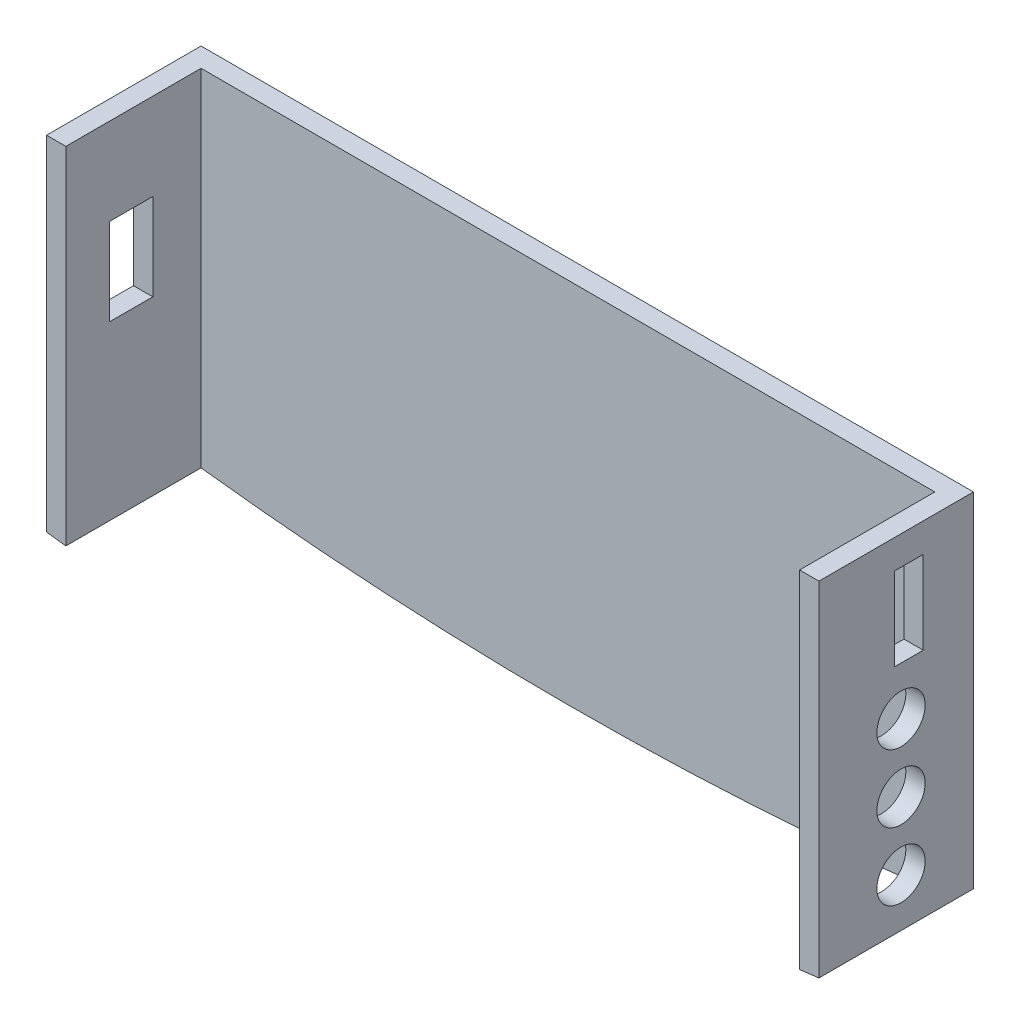
from build123d import *

# Parameters (mm, degrees)
SKETCH_1_W          = 80
SKETCH_1_H          = 35.6
EXTRUDE_1_DEPTH     = 16
SHELL_1_T           = -2
CUT_EXTRUDE_3_REACH = 89.549
SKETCH_2_W          = 4.5
SKETCH_2_H          = 9
CUT_EXTRUDE_4_REACH = 89.549
SKETCH_6_R          = 2.5
SKETCH_6_W          = 3
SKETCH_6_H          = 8.6


with BuildPart() as part:
    # 草图1 → 凸台-拉伸1 (new body)
    with BuildSketch(Plane.XY):
        with Locations((-50.420566467, -11.467328482)):
            Rectangle(SKETCH_1_W, SKETCH_1_H)
        with BuildLine():
            Line((-10.420566467, -29.267328482), (-90.420566467, -29.267328482))
            ThreePointArc((-90.420566467, -29.267328482), (-50.420566467, -31.763413079), (-10.420566467, -29.267328482))
        make_face()
    extrude(amount=EXTRUDE_1_DEPTH)

    # 抽壳1
    shell_1_openings = [part.faces().sort_by_distance(p)[0] for p in [
        (-50.420566467, -12.307426738, 16),
        (-50.420566467, 6.332671518, 8),
        (-50.420566467, -31.763413079, 8),
    ]]
    offset(amount=SHELL_1_T, openings=shell_1_openings, kind=Kind.INTERSECTION)

    # 草图2 → 切除-拉伸3 (cut, up to next)
    with BuildSketch(Plane.ZY.offset(90.420566467), mode=Mode.PRIVATE) as cut_extrude_3_sk1:
        with Locations((9.25, -7.167328482)):
            Rectangle(SKETCH_2_W, SKETCH_2_H)
    cut_extrude_3_tool1 = extrude(cut_extrude_3_sk1.sketch, amount=-CUT_EXTRUDE_3_REACH, mode=Mode.PRIVATE) & part.part
    add(cut_extrude_3_tool1.solids().sort_by_distance((-90.420566, -7.167328, 9.25))[0], mode=Mode.SUBTRACT)

    # 草图6 → 切除-拉伸4 (cut, up to next)
    with BuildSketch(Plane(origin=(-10.420566467, 0, 0), x_dir=(0, 0, -1), z_dir=(1, 0, 0)), mode=Mode.PRIVATE) as cut_extrude_4_sk1:
        with Locations((-7.5, -10.267328482)):
            Circle(SKETCH_6_R)
    cut_extrude_4_tool1 = extrude(cut_extrude_4_sk1.sketch, amount=-CUT_EXTRUDE_4_REACH, mode=Mode.PRIVATE) & part.part
    # 草图6 → 切除-拉伸4 (cut, up to next)
    with BuildSketch(Plane(origin=(-10.420566467, 0, 0), x_dir=(0, 0, -1), z_dir=(1, 0, 0)), mode=Mode.PRIVATE) as cut_extrude_4_sk2:
        with Locations((-7.5, -17.267328482)):
            Circle(SKETCH_6_R)
    cut_extrude_4_tool2 = extrude(cut_extrude_4_sk2.sketch, amount=-CUT_EXTRUDE_4_REACH, mode=Mode.PRIVATE) & part.part
    # 草图6 → 切除-拉伸4 (cut, up to next)
    with BuildSketch(Plane(origin=(-10.420566467, 0, 0), x_dir=(0, 0, -1), z_dir=(1, 0, 0)), mode=Mode.PRIVATE) as cut_extrude_4_sk3:
        with Locations((-7.5, -24.267328482)):
            Circle(SKETCH_6_R)
    cut_extrude_4_tool3 = extrude(cut_extrude_4_sk3.sketch, amount=-CUT_EXTRUDE_4_REACH, mode=Mode.PRIVATE) & part.part
    # 草图6 → 切除-拉伸4 (cut, up to next)
    with BuildSketch(Plane(origin=(-10.420566467, 0, 0), x_dir=(0, 0, -1), z_dir=(1, 0, 0)), mode=Mode.PRIVATE) as cut_extrude_4_sk4:
        with Locations((-6.7, -0.967328482)):
            Rectangle(SKETCH_6_W, SKETCH_6_H)
    cut_extrude_4_tool4 = extrude(cut_extrude_4_sk4.sketch, amount=-CUT_EXTRUDE_4_REACH, mode=Mode.PRIVATE) & part.part
    add(cut_extrude_4_tool1.solids().sort_by_distance((-10.420566, -10.267328, 7.5))[0], mode=Mode.SUBTRACT)
    add(cut_extrude_4_tool2.solids().sort_by_distance((-10.420566, -17.267328, 7.5))[0], mode=Mode.SUBTRACT)
    add(cut_extrude_4_tool3.solids().sort_by_distance((-10.420566, -24.267328, 7.5))[0], mode=Mode.SUBTRACT)
    add(cut_extrude_4_tool4.solids().sort_by_distance((-10.420566, -0.967328, 6.7))[0], mode=Mode.SUBTRACT)


solid = part.part
